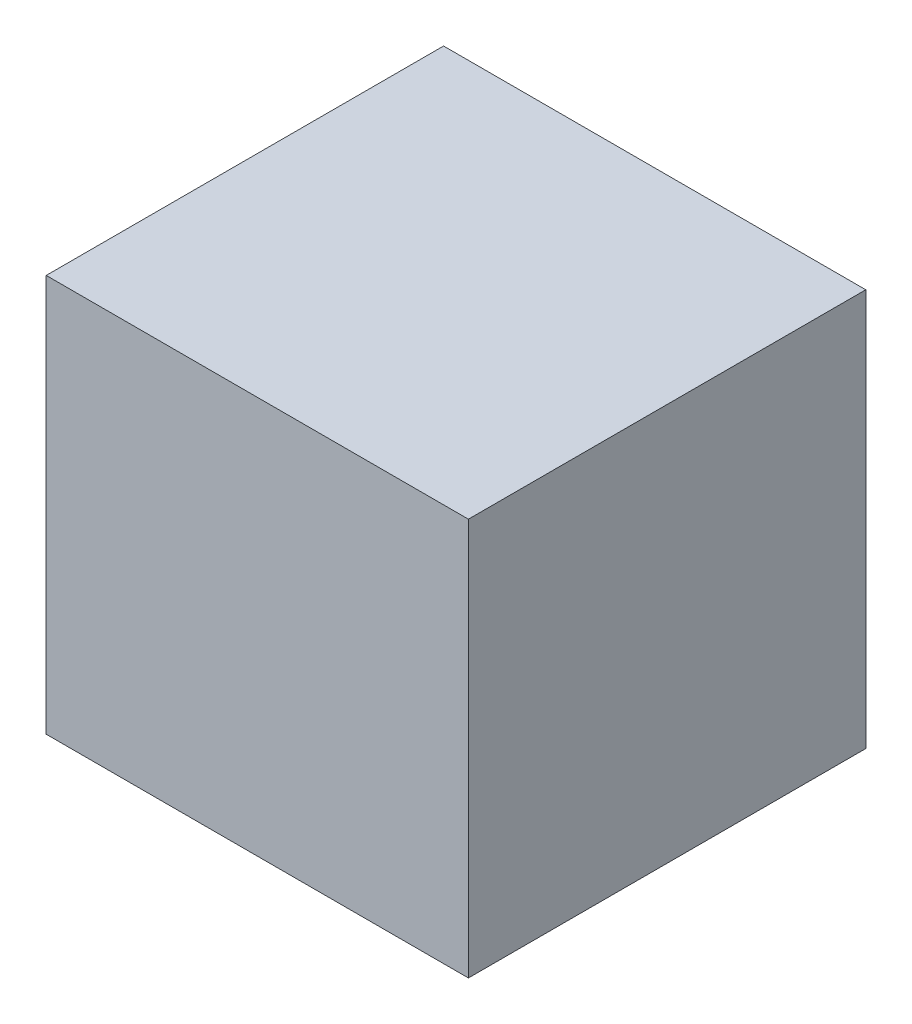
from build123d import *

# Parameters (mm, degrees)
BOSS_EXTRUDE1_START = 39
SKETCH1_W           = 32
SKETCH1_H           = 32
BOSS_EXTRUDE1_DEPTH = 17
CUT_EXTRUDE1_START  = 27
SKETCH2_W           = 13.4
SKETCH2_H           = 12.4
CUT_EXTRUDE1_DEPTH  = 5
CUT_EXTRUDE2_START  = 34.2
SKETCH3_W           = 13.4
SKETCH3_H           = 18.4
CUT_EXTRUDE2_DEPTH  = 2.2


with BuildPart() as part:
    # Sketch1 → Boss-Extrude1 (new, symmetric)
    with BuildSketch(Plane(origin=(0, 0, 0), x_dir=(0, 0, -1), z_dir=(1, 0, 0)).offset(BOSS_EXTRUDE1_START)):
        with Locations((0, 68)):
            Rectangle(SKETCH1_W, SKETCH1_H)
    extrude(amount=BOSS_EXTRUDE1_DEPTH, both=True)

    # Sketch2 → Cut-Extrude1 (cut, symmetric)
    with BuildSketch(Plane(origin=(0, 0, 0), x_dir=(0, 0, -1), z_dir=(1, 0, 0)).offset(CUT_EXTRUDE1_START)):
        with Locations((0, 68)):
            Rectangle(SKETCH2_W, SKETCH2_H)
    extrude(amount=CUT_EXTRUDE1_DEPTH, both=True, mode=Mode.SUBTRACT)

    # Sketch3 → Cut-Extrude2 (cut, symmetric)
    with BuildSketch(Plane(origin=(0, 0, 0), x_dir=(0, 0, -1), z_dir=(1, 0, 0)).offset(CUT_EXTRUDE2_START)):
        with Locations((0, 68)):
            Rectangle(SKETCH3_W, SKETCH3_H)
    extrude(amount=CUT_EXTRUDE2_DEPTH, both=True, mode=Mode.SUBTRACT)


solid = part.part
